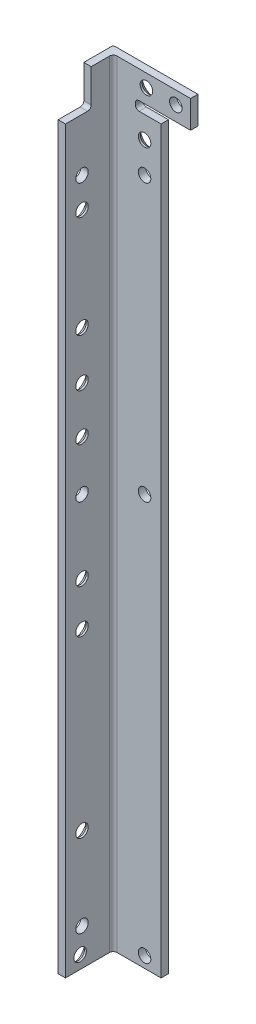
from build123d import *

# Parameters (mm, degrees)
BOSS_EXTRUDE1_DEPTH                             = 211
CSK_FOR_M3_FLAT_HEAD_MACHINE_SCREW1_D           = 3.4
CSK_FOR_M3_FLAT_HEAD_MACHINE_SCREW1_CSINK_D     = 6.3
CSK_FOR_M3_FLAT_HEAD_MACHINE_SCREW1_CSINK_ANGLE = 90
SKETCH7_W                                       = 7
SKETCH7_H                                       = 10
CUT_EXTRUDE1_DEPTH                              = 213.063669684
SKETCH8_W                                       = 7
SKETCH8_H                                       = 2.5
CUT_EXTRUDE2_DEPTH                              = 213.063669684
CSK_FOR_M3_FLAT_HEAD_MACHINE_SCREW2_D           = 3.4
CSK_FOR_M3_FLAT_HEAD_MACHINE_SCREW2_CSINK_D     = 6.3
CSK_FOR_M3_FLAT_HEAD_MACHINE_SCREW2_CSINK_ANGLE = 90
CSK_FOR_M3_FLAT_HEAD_MACHINE_SCREW3_D           = 3.4
CSK_FOR_M3_FLAT_HEAD_MACHINE_SCREW3_CSINK_D     = 6.3
CSK_FOR_M3_FLAT_HEAD_MACHINE_SCREW3_CSINK_ANGLE = 90
FILLET1_R                                       = 0.5
FILLET2_R                                       = 1
FILLET3_R                                       = 1
CUT_EXTRUDE3_START                              = -10
SKETCH17_R                                      = 1.7
CUT_EXTRUDE3_DEPTH                              = 10
CUT_EXTRUDE4_START                              = -10
SKETCH18_R                                      = 1.7
CUT_EXTRUDE4_DEPTH                              = 10
SKETCH19_W                                      = 2
SKETCH19_H                                      = 7.5
BOSS_EXTRUDE2_DEPTH                             = 8
SKETCH20_R                                      = 1.7
CUT_EXTRUDE5_DEPTH                              = 8


with BuildPart() as part:
    # Sketch1 → Boss-Extrude1 (new body)
    with BuildSketch(Plane(origin=(0, 0, 0), x_dir=(1, 0, 0), z_dir=(0, 1, 0))):
        Polygon((0, 15), (0, 0), (2, 0), (2, 13), (15, 13), (15, 15), align=None)
    extrude(amount=BOSS_EXTRUDE1_DEPTH)

    # CSK for M3 Flat Head Machine Screw1 (through all)
    with Locations(Plane.ZY):
        with Locations((-4.5, 178.5483), (-4.5, 150.81169946), (-4.5, 137.8117), (-4.5, 125.120702), (-4.5, 91.71900188), (-4.5, 79.860702), (-4.5, 32.450702)):
            CounterSinkHole(CSK_FOR_M3_FLAT_HEAD_MACHINE_SCREW1_D / 2, CSK_FOR_M3_FLAT_HEAD_MACHINE_SCREW1_CSINK_D / 2, counter_sink_angle=CSK_FOR_M3_FLAT_HEAD_MACHINE_SCREW1_CSINK_ANGLE)

    # Sketch7 → Cut-Extrude1 (cut, through all)
    with BuildSketch(Plane.ZY):
        with Locations((-3.5, 206)):
            Rectangle(SKETCH7_W, SKETCH7_H)
    extrude(amount=-CUT_EXTRUDE1_DEPTH, mode=Mode.SUBTRACT)

    # Sketch8 → Cut-Extrude2 (cut, through all)
    with BuildSketch(Plane(origin=(0, 0, -15), x_dir=(-1, 0, 0), z_dir=(0, 0, -1))):
        with Locations((-11.5, 202.25)):
            Rectangle(SKETCH8_W, SKETCH8_H)
    extrude(amount=-CUT_EXTRUDE2_DEPTH, mode=Mode.SUBTRACT)

    # CSK for M3 Flat Head Machine Screw2 (through all)
    with Locations(Plane(origin=(0, 0, -15), x_dir=(-1, 0, 0), z_dir=(0, 0, -1))):
        with Locations((-11, 207.5), (-10.5, 195)):
            CounterSinkHole(CSK_FOR_M3_FLAT_HEAD_MACHINE_SCREW2_D / 2, CSK_FOR_M3_FLAT_HEAD_MACHINE_SCREW2_CSINK_D / 2, counter_sink_angle=CSK_FOR_M3_FLAT_HEAD_MACHINE_SCREW2_CSINK_ANGLE)

    # CSK for M3 Flat Head Machine Screw3 (through all)
    with Locations(Plane.ZY):
        with Locations((-4, 3.5)):
            CounterSinkHole(CSK_FOR_M3_FLAT_HEAD_MACHINE_SCREW3_D / 2, CSK_FOR_M3_FLAT_HEAD_MACHINE_SCREW3_CSINK_D / 2, counter_sink_angle=CSK_FOR_M3_FLAT_HEAD_MACHINE_SCREW3_CSINK_ANGLE)

    # Fillet1
    fillet1_edges = [part.edges().sort_by_distance(p)[0] for p in [
        (0, 105.5, -15),
    ]]
    fillet(fillet1_edges, radius=FILLET1_R)

    # Fillet2
    fillet2_edges = [part.edges().sort_by_distance(p)[0] for p in [
        (2, 105.5, -13),
    ]]
    fillet(fillet2_edges, radius=FILLET2_R)

    # Fillet3
    fillet3_edges = [part.edges().sort_by_distance(p)[0] for p in [
        (8, 203.5, -14),
        (8, 201, -14),
        (1, 201, -7),
    ]]
    fillet(fillet3_edges, radius=FILLET3_R)

    # Sketch17 → Cut-Extrude3 (cut)
    with BuildSketch(Plane.ZY.offset(CUT_EXTRUDE3_START)):
        with Locations((-4.5, 178.5483)):
            Circle(SKETCH17_R)
        with Locations((-4.5, 186.68)):
            Circle(SKETCH17_R)
        with Locations((-4.5, 111.59)):
            Circle(SKETCH17_R)
        with Locations((-4.5, 10)):
            Circle(SKETCH17_R)
    extrude(amount=CUT_EXTRUDE3_DEPTH, mode=Mode.SUBTRACT)

    # Sketch18 → Cut-Extrude4 (cut)
    with BuildSketch(Plane(origin=(0, 0, -15), x_dir=(-1, 0, 0), z_dir=(0, 0, -1)).offset(CUT_EXTRUDE4_START)):
        with Locations((-10.5, 186.68)):
            Circle(SKETCH18_R)
        with Locations((-10.5, 111.59)):
            Circle(SKETCH18_R)
        with Locations((-10.5, 3)):
            Circle(SKETCH18_R)
        with Locations((-10.5, 195)):
            Circle(SKETCH18_R)
    extrude(amount=CUT_EXTRUDE4_DEPTH, mode=Mode.SUBTRACT)

    # Sketch19 → Boss-Extrude2 (add)
    with BuildSketch(Plane(origin=(15, 0, 0), x_dir=(0, 0, -1), z_dir=(1, 0, 0))):
        with Locations((14, 207.25)):
            Rectangle(SKETCH19_W, SKETCH19_H)
    extrude(amount=BOSS_EXTRUDE2_DEPTH)

    # Sketch20 → Cut-Extrude5 (cut)
    with BuildSketch(Plane.XY.offset(-13)):
        with Locations((19, 207.5)):
            Circle(SKETCH20_R)
    extrude(amount=-CUT_EXTRUDE5_DEPTH, mode=Mode.SUBTRACT)


solid = part.part
